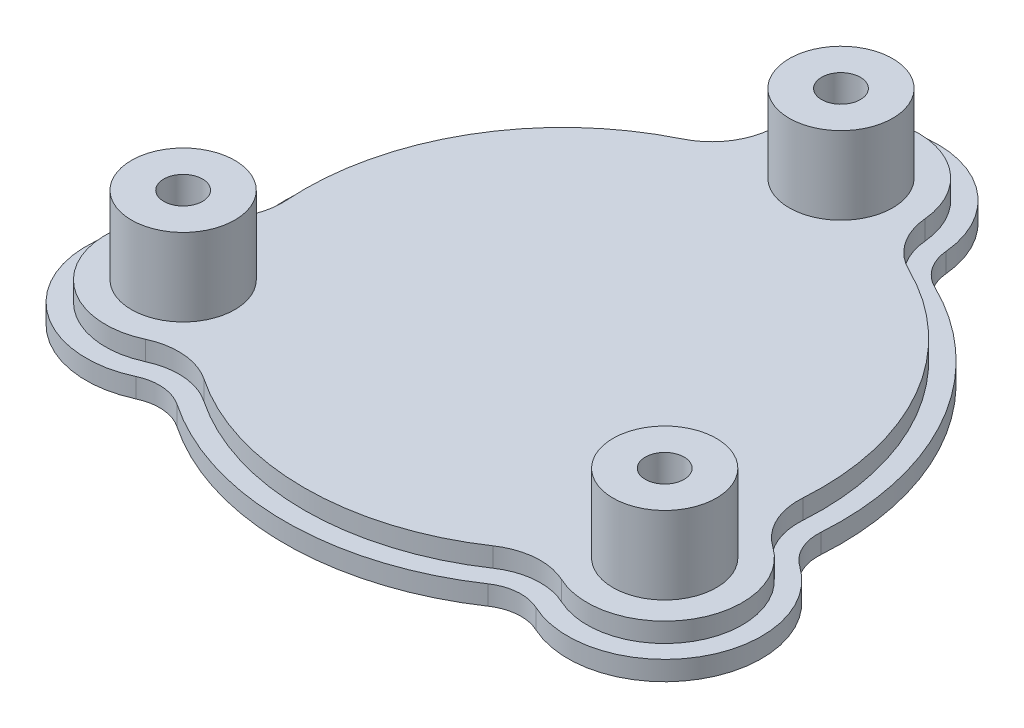
from build123d import *

# Parameters (mm, degrees)
SKETCH1_R           = 6
BOSS_EXTRUDE1_DEPTH = 3
SKETCH2_R           = 6
BOSS_EXTRUDE2_DEPTH = 3
SKETCH3_R           = 8
SKETCH3_R_2         = 6
BOSS_EXTRUDE3_DEPTH = 6
BOSS_EXTRUDE4_START = 6
SKETCH3_4_R         = 8
SKETCH3_4_R_2       = 6
SKETCH3_4_R_3       = 3
BOSS_EXTRUDE4_DEPTH = 6


with BuildPart() as part:
    # Sketch1 → Boss-Extrude1 (new body)
    with BuildSketch(Plane(origin=(0, 0, 0), x_dir=(1, 0, 0), z_dir=(0, 1, 0))):
        with BuildLine():
            ThreePointArc((42.894958583, -3.003752345), (43.557934635, -6.502479184), (45.856433127, -9.222319513))
            ThreePointArc((45.856433127, -9.222319513), (50.22947342, -29), (30.914979544, -35.101676259))
            ThreePointArc((30.914979544, -35.101676259), (27.410279478, -34.471038339), (24.048805129, -35.646247655))
            ThreePointArc((24.048805129, -35.646247655), (0, -43), (-24.048805129, -35.646247655))
            ThreePointArc((-24.048805129, -35.646247655), (-27.410279478, -34.471038339), (-30.914979544, -35.101676259))
            ThreePointArc((-30.914979544, -35.101676259), (-50.229473419, -29), (-45.856433127, -9.222319513))
            ThreePointArc((-45.856433127, -9.222319513), (-43.557934635, -6.502479184), (-42.894958583, -3.003752345))
            ThreePointArc((-42.894958583, -3.003752345), (-37.239092363, 21.5), (-18.846153454, 38.65))
            ThreePointArc((-18.846153454, 38.65), (-16.147655157, 40.973517523), (-14.941453584, 44.323995772))
            ThreePointArc((-14.941453584, 44.323995772), (0, 58), (14.941453584, 44.323995772))
            ThreePointArc((14.941453584, 44.323995772), (16.147655157, 40.973517523), (18.846153454, 38.65))
            ThreePointArc((18.846153454, 38.65), (37.239092363, 21.5), (42.894958583, -3.003752345))
        make_face()
        with Locations(Location((0, 43, 0), (0, 0, 270))):
            Circle(SKETCH1_R, mode=Mode.SUBTRACT)
        with Locations(Location((37.239092363, -21.5, 0), (0, 0, 270))):
            Circle(SKETCH1_R, mode=Mode.SUBTRACT)
        with Locations(Location((-37.239092363, -21.5, 0), (0, 0, 270))):
            Circle(SKETCH1_R, mode=Mode.SUBTRACT)
    extrude(amount=BOSS_EXTRUDE1_DEPTH)

    # Sketch2 → Boss-Extrude2 (add)
    with BuildSketch(Plane(origin=(0, 3, 0), x_dir=(1, 0, 0), z_dir=(0, 1, 0))):
        with BuildLine():
            ThreePointArc((39.902287054, -2.794188228), (40.8493957, -7.792369426), (44.132964974, -11.67785561))
            ThreePointArc((44.132964974, -11.67785561), (47.631397208, -27.5), (32.179802107, -32.381341007))
            ThreePointArc((32.179802107, -32.381341007), (27.173087728, -31.480429693), (22.370981516, -33.159300144))
            ThreePointArc((22.370981516, -33.159300144), (0, -40), (-22.370981516, -33.159300144))
            ThreePointArc((-22.370981516, -33.159300144), (-27.173087728, -31.480429693), (-32.179802107, -32.381341007))
            ThreePointArc((-32.179802107, -32.381341007), (-47.631397208, -27.5), (-44.132964974, -11.67785561))
            ThreePointArc((-44.132964974, -11.67785561), (-40.8493957, -7.792369426), (-39.902287054, -2.794188228))
            ThreePointArc((-39.902287054, -2.794188228), (-34.641016151, 20), (-17.531305538, 35.953488372))
            ThreePointArc((-17.531305538, 35.953488372), (-13.676307972, 39.272799119), (-11.953162867, 44.059196617))
            ThreePointArc((-11.953162867, 44.059196617), (0, 55), (11.953162867, 44.059196617))
            ThreePointArc((11.953162867, 44.059196617), (13.676307972, 39.272799119), (17.531305538, 35.953488372))
            ThreePointArc((17.531305538, 35.953488372), (34.641016151, 20), (39.902287054, -2.794188228))
        make_face()
        with Locations(Location((-37.239092363, -21.5, 0), (0, 0, 270))):
            Circle(SKETCH2_R, mode=Mode.SUBTRACT)
        with Locations(Location((37.239092363, -21.5, 0), (0, 0, 270))):
            Circle(SKETCH2_R, mode=Mode.SUBTRACT)
        with Locations(Location((0, 43, 0), (0, 0, 270))):
            Circle(SKETCH2_R, mode=Mode.SUBTRACT)
    extrude(amount=BOSS_EXTRUDE2_DEPTH)

    # Sketch3 → Boss-Extrude3 (add)
    # profile 1 of 3: a face of its own
    with BuildSketch(Plane(origin=(0, 6, 0), x_dir=(1, 0, 0), z_dir=(0, 1, 0))):
        with Locations(Location((-37.239092363, -21.5, 0), (0, 0, 270))):
            Circle(SKETCH3_R)
        with Locations(Location((-37.239092363, -21.5, 0), (0, 0, 270))):
            Circle(SKETCH3_R_2, mode=Mode.SUBTRACT)
    # profile 2 of 3: a face of its own
    with BuildSketch(Plane(origin=(0, 6, 0), x_dir=(1, 0, 0), z_dir=(0, 1, 0))):
        with Locations(Location((0, 43, 0), (0, 0, 270))):
            Circle(SKETCH3_R)
        with Locations(Location((0, 43, 0), (0, 0, 270))):
            Circle(SKETCH3_R_2, mode=Mode.SUBTRACT)
    # profile 3 of 3: a face of its own
    with BuildSketch(Plane(origin=(0, 6, 0), x_dir=(1, 0, 0), z_dir=(0, 1, 0))):
        with Locations(Location((37.239092363, -21.5, 0), (0, 0, 270))):
            Circle(SKETCH3_R)
        with Locations(Location((37.239092363, -21.5, 0), (0, 0, 270))):
            Circle(SKETCH3_R_2, mode=Mode.SUBTRACT)
    extrude(amount=BOSS_EXTRUDE3_DEPTH)

    # Sketch3<4> → Boss-Extrude4 (add)
    # profile 1 of 6: a face of its own
    with BuildSketch(Plane(origin=(0, 6, 0), x_dir=(1, 0, 0), z_dir=(0, 1, 0)).offset(BOSS_EXTRUDE4_START)):
        with Locations(Location((-37.239092363, -21.5, 0), (0, 0, 270))):
            Circle(SKETCH3_4_R)
        with Locations(Location((-37.239092363, -21.5, 0), (0, 0, 270))):
            Circle(SKETCH3_4_R_2, mode=Mode.SUBTRACT)
    # profile 2 of 6: a face of its own
    with BuildSketch(Plane(origin=(0, 6, 0), x_dir=(1, 0, 0), z_dir=(0, 1, 0)).offset(BOSS_EXTRUDE4_START)):
        with Locations(Location((-37.239092363, -21.5, 0), (0, 0, 270))):
            Circle(SKETCH3_4_R_2)
        with Locations(Location((-37.239092363, -21.5, 0), (0, 0, 270))):
            Circle(SKETCH3_4_R_3, mode=Mode.SUBTRACT)
    # profile 3 of 6: a face of its own
    with BuildSketch(Plane(origin=(0, 6, 0), x_dir=(1, 0, 0), z_dir=(0, 1, 0)).offset(BOSS_EXTRUDE4_START)):
        with Locations(Location((0, 43, 0), (0, 0, 270))):
            Circle(SKETCH3_4_R)
        with Locations(Location((0, 43, 0), (0, 0, 270))):
            Circle(SKETCH3_4_R_2, mode=Mode.SUBTRACT)
    # profile 4 of 6: a face of its own
    with BuildSketch(Plane(origin=(0, 6, 0), x_dir=(1, 0, 0), z_dir=(0, 1, 0)).offset(BOSS_EXTRUDE4_START)):
        with Locations(Location((0, 43, 0), (0, 0, 270))):
            Circle(SKETCH3_4_R_2)
        with Locations(Location((0, 43, 0), (0, 0, 270))):
            Circle(SKETCH3_4_R_3, mode=Mode.SUBTRACT)
    # profile 5 of 6: a face of its own
    with BuildSketch(Plane(origin=(0, 6, 0), x_dir=(1, 0, 0), z_dir=(0, 1, 0)).offset(BOSS_EXTRUDE4_START)):
        with Locations(Location((37.239092363, -21.5, 0), (0, 0, 270))):
            Circle(SKETCH3_4_R)
        with Locations(Location((37.239092363, -21.5, 0), (0, 0, 270))):
            Circle(SKETCH3_4_R_2, mode=Mode.SUBTRACT)
    # profile 6 of 6: a face of its own
    with BuildSketch(Plane(origin=(0, 6, 0), x_dir=(1, 0, 0), z_dir=(0, 1, 0)).offset(BOSS_EXTRUDE4_START)):
        with Locations(Location((37.239092363, -21.5, 0), (0, 0, 270))):
            Circle(SKETCH3_4_R_2)
        with Locations(Location((37.239092363, -21.5, 0), (0, 0, 270))):
            Circle(SKETCH3_4_R_3, mode=Mode.SUBTRACT)
    extrude(amount=BOSS_EXTRUDE4_DEPTH)


solid = part.part
